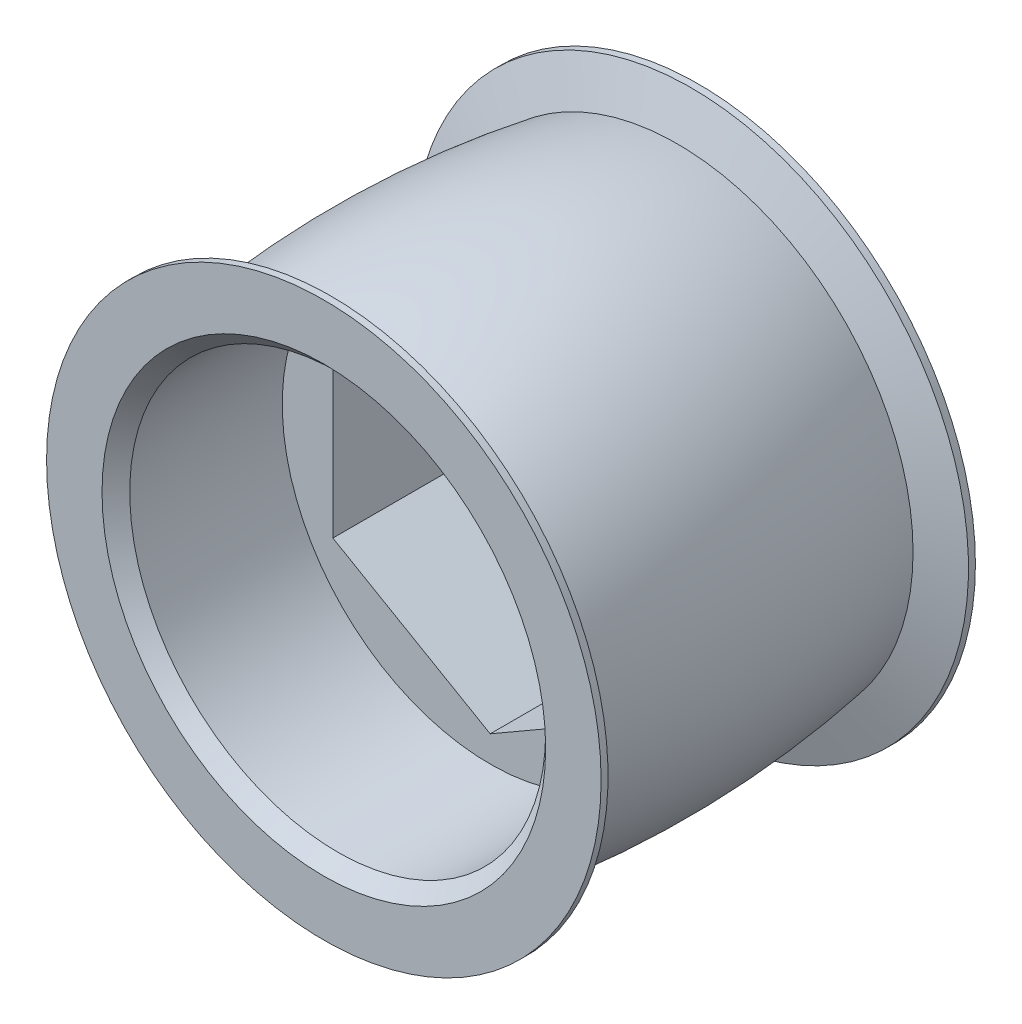
from build123d import *

# Parameters (mm, degrees)
ESQUISSE1_R              = 20
ESQUISSE1_R_2            = 3.25
BOSS_EXTRU_1_DEPTH       = 15
ESQUISSE2_R              = 20
ESQUISSE2_R_2            = 15
BOSS_EXTRU_2_DEPTH       = 12
ENL_V_MAT_EXTRU_9_DEPTH  = 8
CHANFREIN1_SIZE          = 1
ESQUISSE11_R             = 1.25
ENL_V_MAT_EXTRU_10_DEPTH = 40.102429592
ESQUISSE12_R             = 4.25
ENL_V_MAT_EXTRU_11_DEPTH = 4


with BuildPart() as part:
    # Esquisse1 → Boss.-Extru.1 (new body)
    with BuildSketch(Plane.XY):
        Circle(ESQUISSE1_R)
        Circle(ESQUISSE1_R_2, mode=Mode.SUBTRACT)
    extrude(amount=BOSS_EXTRU_1_DEPTH)

    # Esquisse2 → Boss.-Extru.2 (add)
    with BuildSketch(Plane.XY.offset(15)):
        Circle(ESQUISSE2_R)
        Circle(ESQUISSE2_R_2, mode=Mode.SUBTRACT)
    extrude(amount=BOSS_EXTRU_2_DEPTH)

    # Esquisse9 → Enlèv. mat.-Extru.9 (cut)
    with BuildSketch(Plane.XY.offset(15)):
        Polygon((11.35, -6.552925555), (11.35, 6.552925555), (0, 13.105851111), (-11.35, 6.552925555), (-11.35, -6.552925555), (0, -13.105851111), align=None)
    extrude(amount=-ENL_V_MAT_EXTRU_9_DEPTH, mode=Mode.SUBTRACT)

    # Chanfrein1
    chanfrein1_edges = [part.edges().sort_by_distance(p)[0] for p in [
        (-15, 0, 27),
    ]]
    chamfer(chanfrein1_edges, length=CHANFREIN1_SIZE)

    # Esquisse10 → Enlèvement de matière-Révolution1 (revolve, cut)
    with BuildSketch(Plane(origin=(0, 0, 0), x_dir=(0, 0, -1), z_dir=(1, 0, 0)), mode=Mode.PRIVATE) as enl_vement_de_mati_re_r_volution1_sk:
        with BuildLine():
            Line((-26.5, 20), (-0.5, 20))
            Line((-0.5, 20), (-1.5, 17))
            ThreePointArc((-1.5, 17), (-13.5, 18), (-25.5, 17))
            Line((-25.5, 17), (-26.5, 20))
        make_face()
    revolve(enl_vement_de_mati_re_r_volution1_sk.sketch.rotate(Axis((0, 0, 0), (0, 0, 1)), 90), axis=Axis((0, 0, 0), (0, 0, 1)), mode=Mode.SUBTRACT)

    # Esquisse11 → Enlèv. mat.-Extru.10 (cut, through all)
    with BuildSketch(Plane(origin=(0, 0, 0), x_dir=(-1, 0, 0), z_dir=(0, 0, -1))):
        with Locations((-6.92820323, 4)):
            Circle(ESQUISSE11_R)
        with Locations((6.92820323, 4)):
            Circle(ESQUISSE11_R)
        with Locations((0, -8)):
            Circle(ESQUISSE11_R)
    extrude(amount=-ENL_V_MAT_EXTRU_10_DEPTH, mode=Mode.SUBTRACT)

    # Esquisse12 → Enlèv. mat.-Extru.11 (cut)
    with BuildSketch(Plane(origin=(0, 0, 0), x_dir=(-1, 0, 0), z_dir=(0, 0, -1))):
        with Locations((-6.92820323, 4)):
            Circle(ESQUISSE12_R)
        with Locations((6.92820323, 4)):
            Circle(ESQUISSE12_R)
        with Locations((0, -8)):
            Circle(ESQUISSE12_R)
    extrude(amount=-ENL_V_MAT_EXTRU_11_DEPTH, mode=Mode.SUBTRACT)


solid = part.part
